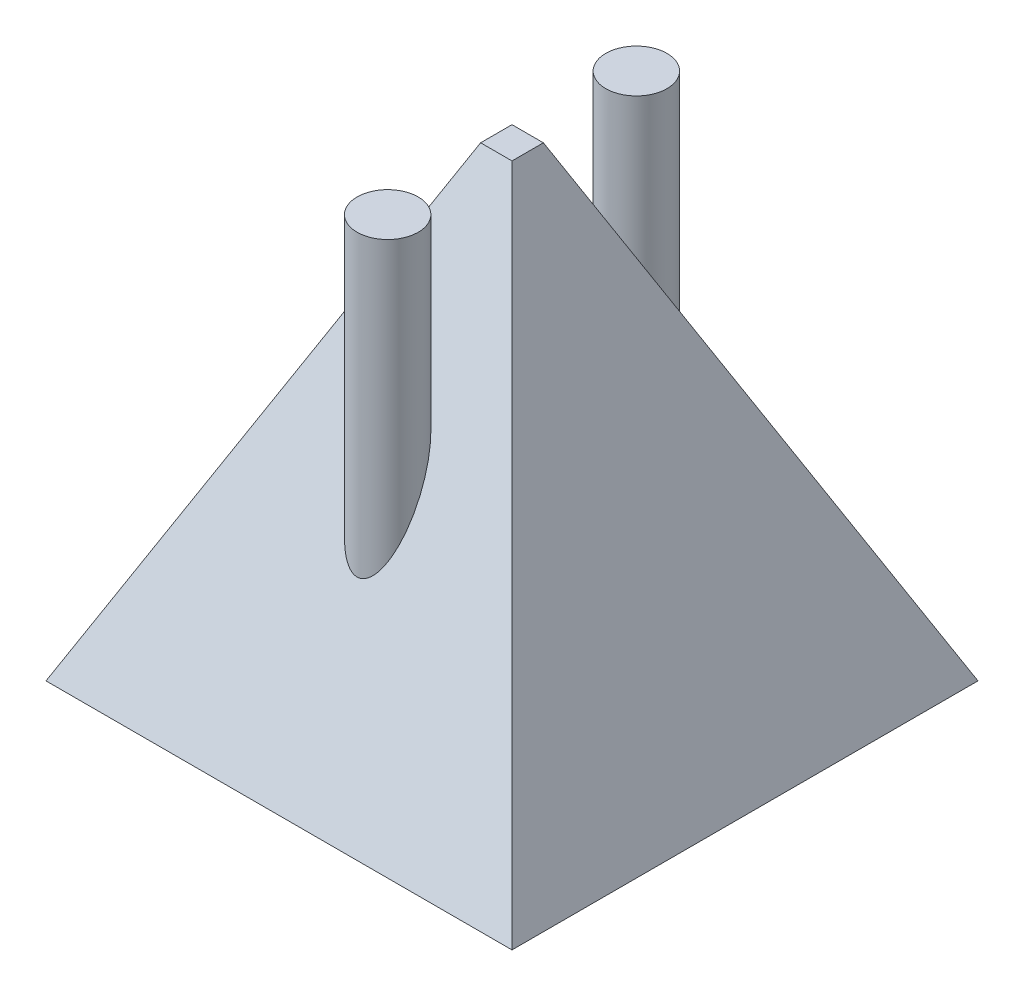
from build123d import *

# Parameters (mm, degrees)
SKETCH1_W           = 38.1
SKETCH1_H           = 38.1
BOSS_EXTRUDE1_DEPTH = 19.05
DRAFT1_ANGLE        = -25
SKETCH2_R           = 2.5
BOSS_EXTRUDE3_DEPTH = 19.05


with BuildPart() as part:
    # Sketch1 → Boss-Extrude1 (new, symmetric)
    with BuildSketch(Plane(origin=(0, 0, 0), x_dir=(1, 0, 0), z_dir=(0, 1, 0))):
        Rectangle(SKETCH1_W, SKETCH1_H)
    extrude(amount=BOSS_EXTRUDE1_DEPTH, both=True)

    # Draft1
    draft1_faces = [part.faces().sort_by_distance(p)[0] for p in [
        (-19.05, 0, 0),
        (0, 0, 19.05),
        (19.05, 0, 0),
        (0, 0, -19.05),
    ]]
    draft(draft1_faces, Plane(origin=(0, -19.05, 0), x_dir=(0, 0, -1), z_dir=(0, -1, 0)), DRAFT1_ANGLE)

    # Sketch2 → Boss-Extrude3 (add, symmetric)
    with BuildSketch(Plane(origin=(0, 0, 0), x_dir=(1, 0, 0), z_dir=(0, 1, 0))):
        with Locations(Location((0, 10.166839112, 0), (0, 0, 90))):
            Circle(SKETCH2_R)
        with Locations(Location((0, -10.166839112, 0), (0, 0, 90))):
            Circle(SKETCH2_R)
    extrude(amount=BOSS_EXTRUDE3_DEPTH, both=True)


solid = part.part
